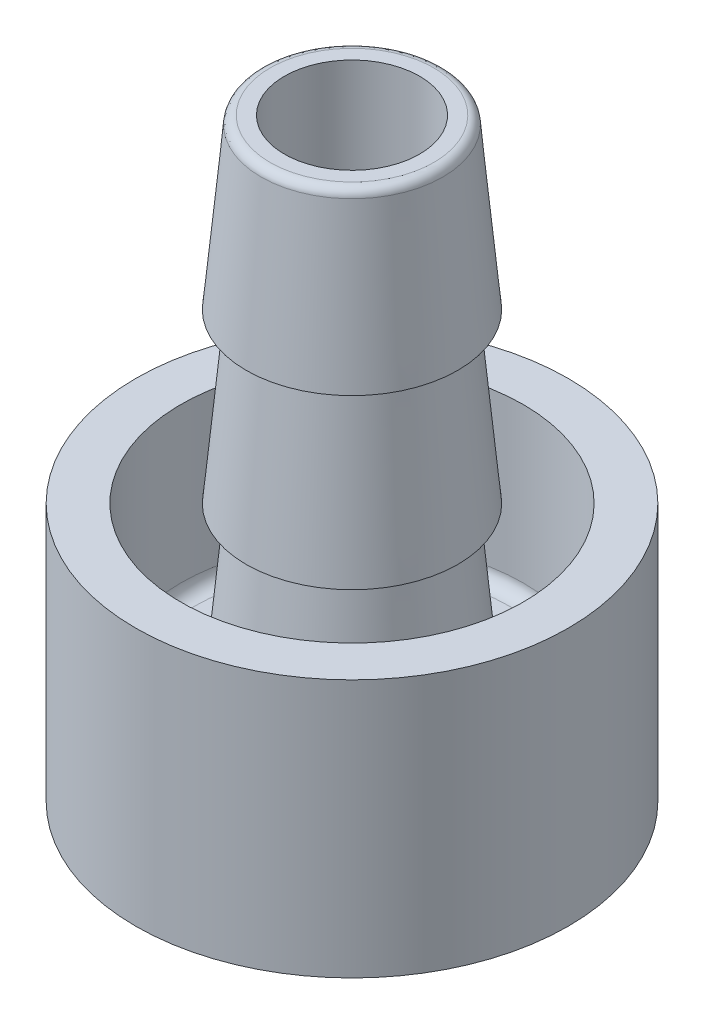
from build123d import *

# Parameters (mm, degrees)
REDONDEO1_R           = 0.2
CORTAR_EXTRUIR1_DEPTH = 1.25
REDONDEO2_R           = 0.3
REDONDEO3_R           = 0.3


with BuildPart() as part:
    # Croquis1 → Revolución1 (revolve)
    with BuildSketch(Plane.XY, mode=Mode.PRIVATE) as revoluci_n1_sk:
        Polygon((2, 11.2), (2.35, 7.47), (2, 7.47), (2.35, 3.74), (2, 3.74), (2.35, 0.01), (3.8, 0.01), (3.8, 3.74), (4.8, 3.74), (4.8, -1.99), (1.3, -1.99), (1.3, 3), (1.5, 5.605), (1.5, 11.2), align=None)
    revolve(revoluci_n1_sk.sketch.rotate(Axis((0, 0, 0), (0, 1, 0)), 90), axis=Axis((0, 0, 0), (0, 1, 0)))

    # Redondeo1
    redondeo1_edges = [part.edges().sort_by_distance(p)[0] for p in [
        (0, 11.2, 2),
    ]]
    fillet(redondeo1_edges, radius=REDONDEO1_R)

    # Croquis2 → Cortar-Extruir1 (cut)
    with BuildSketch(Plane.XZ.offset(1.99)):
        with BuildLine():
            Line((2.15, 0.7), (2.15, -0.7))
            ThreePointArc((2.15, -0.7), (1.725304833, -1.725304833), (0.7, -2.15))
            Line((0.7, -2.15), (-0.994365081, -2.15))
            ThreePointArc((-0.994365081, -2.15), (-1.223975141, -2.10432772), (-1.41862915, -1.974264069))
            Line((-1.41862915, -1.974264069), (-1.974264069, -1.41862915))
            ThreePointArc((-1.974264069, -1.41862915), (-2.10432772, -1.223975141), (-2.15, -0.994365081))
            Line((-2.15, -0.994365081), (-2.15, 0.7))
            ThreePointArc((-2.15, 0.7), (-1.725304833, 1.725304833), (-0.7, 2.15))
            Line((-0.7, 2.15), (0.7, 2.15))
            ThreePointArc((0.7, 2.15), (1.725304833, 1.725304833), (2.15, 0.7))
        make_face()
    extrude(amount=-CORTAR_EXTRUIR1_DEPTH, mode=Mode.SUBTRACT)

    # Redondeo2
    redondeo2_edges = [part.edges().sort_by_distance(p)[0] for p in [
        (1.725304833, -0.74, 1.725304833),
        (2.15, -0.74, 0),
        (1.725304833, -0.74, -1.725304833),
        (-0.147182541, -0.74, -2.15),
        (-1.223975141, -0.74, -2.10432772),
        (-1.696446609, -0.74, -1.696446609),
        (-2.10432772, -0.74, -1.223975141),
        (-2.15, -0.74, -0.147182541),
        (-1.725304833, -0.74, 1.725304833),
        (0, -0.74, 2.15),
        (0, -0.74, 1.3),
        (1.725304833, -1.99, 1.725304833),
        (0, -1.99, 2.15),
        (-1.725304833, -1.99, 1.725304833),
        (-2.15, -1.99, -0.147182541),
        (-2.10432772, -1.99, -1.223975141),
        (-1.696446609, -1.99, -1.696446609),
        (-1.223975141, -1.99, -2.10432772),
        (-0.147182541, -1.99, -2.15),
        (1.725304833, -1.99, -1.725304833),
        (2.15, -1.99, 0),
    ]]
    fillet(redondeo2_edges, radius=REDONDEO2_R)

    # Redondeo3
    redondeo3_edges = [part.edges().sort_by_distance(p)[0] for p in [
        (0, 0.01, 3.8),
    ]]
    fillet(redondeo3_edges, radius=REDONDEO3_R)


solid = part.part
